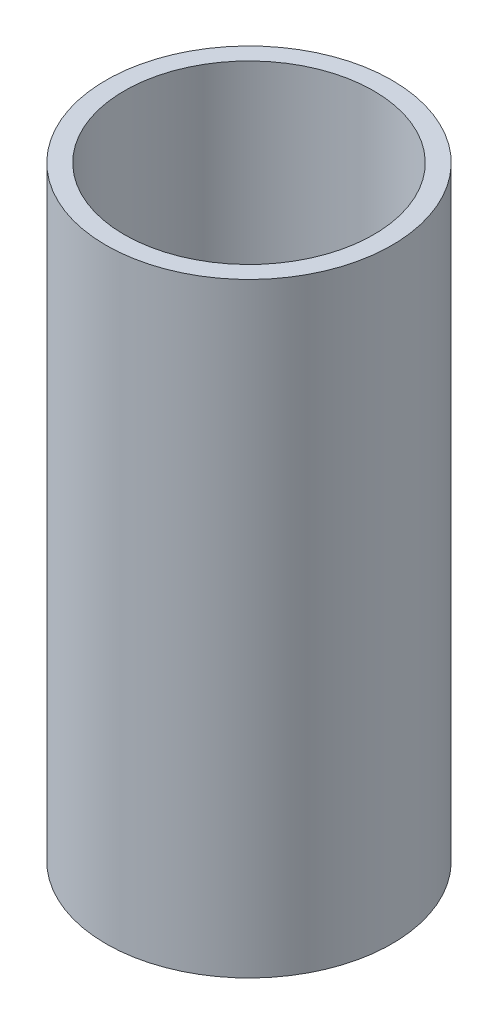
from build123d import *

# Parameters (mm, degrees)
SKETCH1_R           = 39
BOSS_EXTRUDE1_DEPTH = 165
SKETCH2_R           = 31.5
CUT_EXTRUDE1_DEPTH  = 25
SKETCH3_R           = 34
CUT_EXTRUDE2_DEPTH  = 140


with BuildPart() as part:
    # Sketch1 → Boss-Extrude1 (new body)
    with BuildSketch(Plane(origin=(0, 0, 0), x_dir=(1, 0, 0), z_dir=(0, 1, 0))):
        with Locations(Location((0, 0, 0), (0, 0, 270))):
            Circle(SKETCH1_R)
    extrude(amount=BOSS_EXTRUDE1_DEPTH)

    # Sketch2 → Cut-Extrude1 (cut)
    with BuildSketch(Plane.XZ):
        with Locations(Location((0, 0, 0), (0, 0, 270))):
            Circle(SKETCH2_R)
    extrude(amount=-CUT_EXTRUDE1_DEPTH, mode=Mode.SUBTRACT)

    # Sketch3 → Cut-Extrude2 (cut)
    with BuildSketch(Plane(origin=(0, 165, 0), x_dir=(1, 0, 0), z_dir=(0, 1, 0))):
        with Locations(Location((0, 0, 0), (0, 0, 270))):
            Circle(SKETCH3_R)
    extrude(amount=-CUT_EXTRUDE2_DEPTH, mode=Mode.SUBTRACT)


solid = part.part
